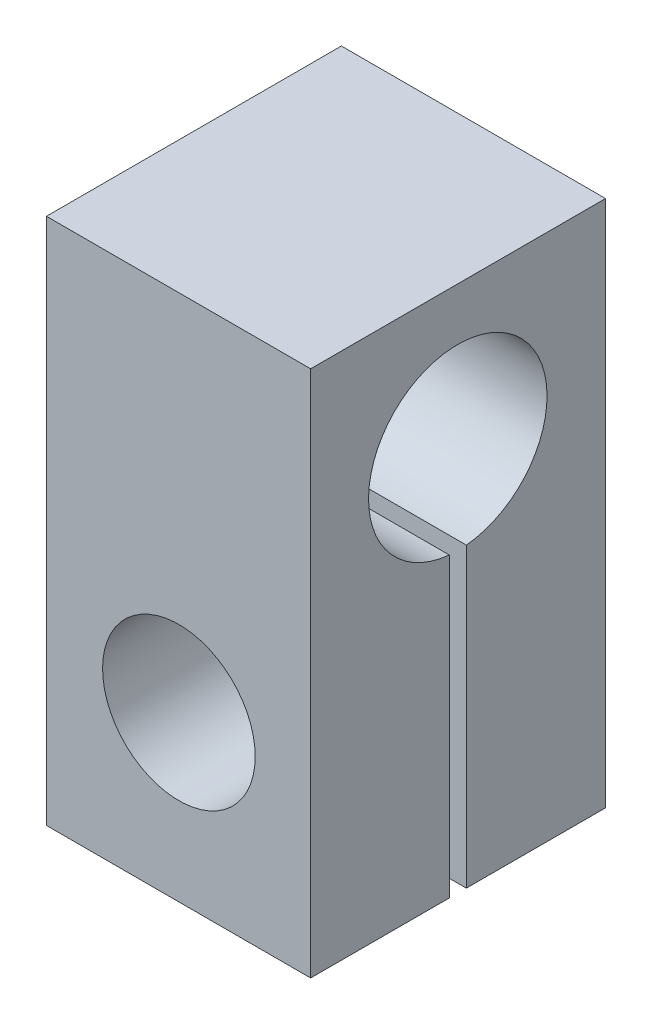
from build123d import *

# Parameters (mm, degrees)
BOSS_EXTRUDE2_DEPTH = 4.5
SKETCH3_R           = 1.3
CUT_EXTRUDE1_DEPTH  = 10.5


with BuildPart() as part:
    # Sketch1 → Boss-Extrude2 (new body)
    with BuildSketch(Plane(origin=(0, 0, 0), x_dir=(0, 0, -1), z_dir=(1, 0, 0))):
        with BuildLine():
            Line((1.55613054, -9.91539795), (3.917713804, -9.916320319))
            Line((3.917713804, -9.916320319), (3.917713804, -4.855498596))
            ThreePointArc((3.917713804, -4.855498596), (4.062635704, -1.822441499), (4.208325788, -4.855461794))
            Line((4.208325788, -4.855461794), (4.208325788, -9.916433824))
            Line((4.208325788, -9.916433824), (6.579674081, -9.917360006))
            Line((6.579674081, -9.917360006), (6.579674081, -0.928463249))
            Line((6.579674081, -0.928463249), (1.55613054, -0.928463249))
            Line((1.55613054, -0.928463249), (1.55613054, -9.91539795))
        make_face()
    extrude(amount=BOSS_EXTRUDE2_DEPTH)

    # Sketch3 → Cut-Extrude1 (cut)
    with BuildSketch(Plane.XY.offset(-1.55613054)):
        with Locations((2.256029543, -7.121731935)):
            Circle(SKETCH3_R)
    extrude(amount=-CUT_EXTRUDE1_DEPTH, mode=Mode.SUBTRACT)


solid = part.part
